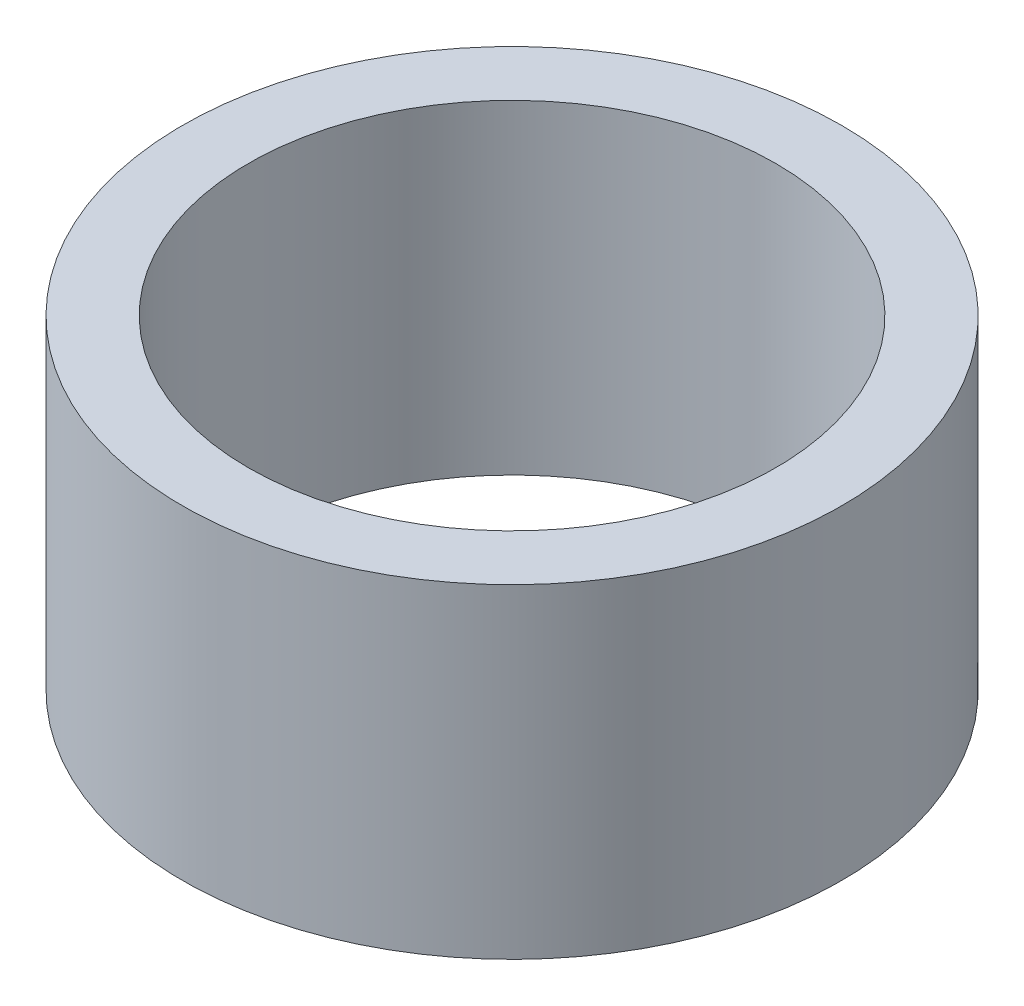
from build123d import *

# Parameters (mm, degrees)
SKETCH1_W = 4.1275
SKETCH1_H = 20.32


with BuildPart() as part:
    # Sketch1 → Revolve1 (revolve)
    with BuildSketch(Plane.XY, mode=Mode.PRIVATE) as revolve1_sk:
        with Locations((18.57375, 10.16)):
            Rectangle(SKETCH1_W, SKETCH1_H)
    revolve(revolve1_sk.sketch.rotate(Axis((0, 0, 0), (0, 1, 0)), 90), axis=Axis((0, 0, 0), (0, 1, 0)))


solid = part.part
